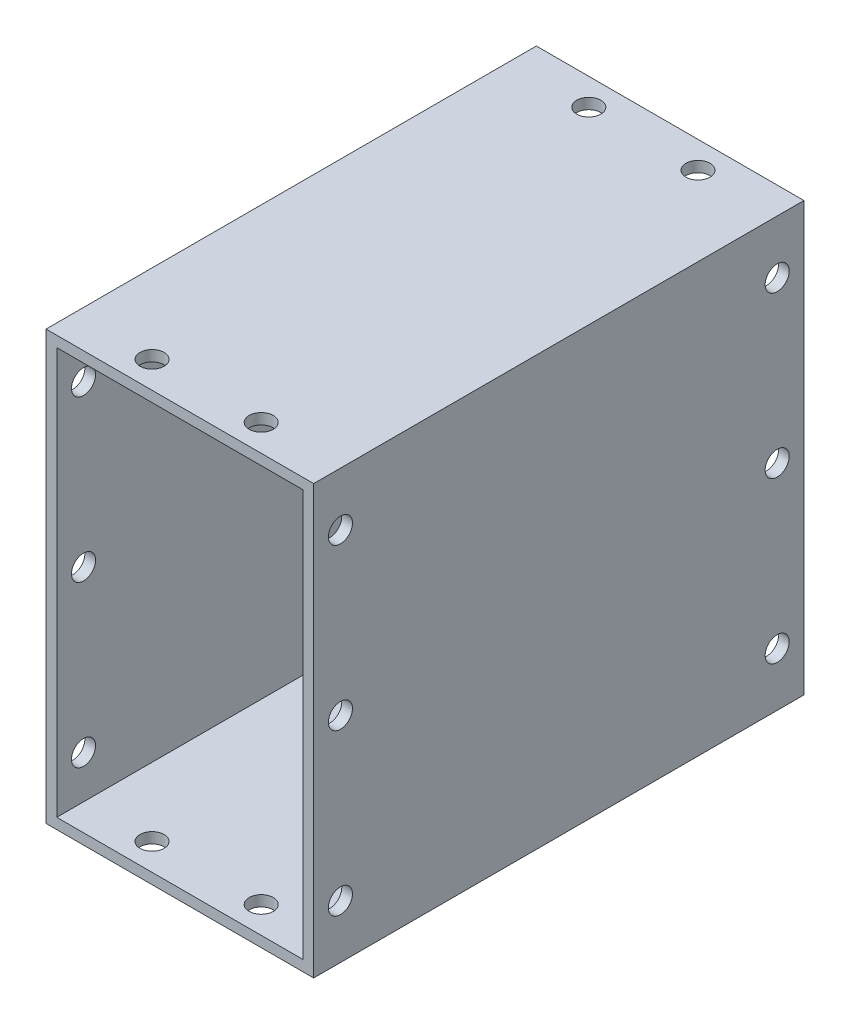
from build123d import *

# Parameters (mm, degrees)
SKETCH1_W                      = 50
SKETCH1_H                      = 80
SKETCH1_W_2                    = 46
SKETCH1_H_2                    = 76
BOSS_EXTRUDE1_DEPTH            = 91.6
M4_CLEARANCE_HOLE1_D           = 4.5
M4_CLEARANCE_HOLE1_ON_FACE_2_D = 4.5
M4_CLEARANCE_HOLE1_ON_FACE_3_D = 4.5
M4_CLEARANCE_HOLE1_ON_FACE_4_D = 4.5


with BuildPart() as part:
    # Sketch1 → Boss-Extrude1 (new body)
    with BuildSketch(Plane.XY.offset(60)):
        Rectangle(SKETCH1_W, SKETCH1_H)
        Rectangle(SKETCH1_W_2, SKETCH1_H_2, mode=Mode.SUBTRACT)
    extrude(amount=BOSS_EXTRUDE1_DEPTH)

    # M4 Clearance Hole1 (through all)
    with Locations(Plane(origin=(25, 30, 65), x_dir=(0, 1, 0), z_dir=(1, 0, 0))):
        with Locations((0, 0), (-30, 0), (-60, 0), (-60, 81.6), (-30, 81.6), (0, 81.6)):
            Hole(M4_CLEARANCE_HOLE1_D / 2)

    # M4 Clearance Hole1 on face 2 (through all)
    with Locations(Plane(origin=(10.2, -40, 65), x_dir=(0, 0, -1), z_dir=(0, -1, 0))):
        with Locations((0, 0), (0, -20.4), (-81.6, -20.4), (-81.6, 0)):
            Hole(M4_CLEARANCE_HOLE1_ON_FACE_2_D / 2)

    # M4 Clearance Hole1 on face 3 (through all)
    with Locations(Plane(origin=(-25, -30, 65), x_dir=(0, 0, -1), z_dir=(-1, 0, 0))):
        with Locations((0, 0), (0, -60), (0, -30), (-81.6, -60), (-81.6, -30), (-81.6, 0)):
            Hole(M4_CLEARANCE_HOLE1_ON_FACE_3_D / 2)

    # M4 Clearance Hole1 on face 4 (through all)
    with Locations(Plane(origin=(10.2, 40, 65), x_dir=(0, 0, 1), z_dir=(0, 1, 0))):
        with Locations((0, 0), (0, -20.4), (81.6, 0), (81.6, -20.4)):
            Hole(M4_CLEARANCE_HOLE1_ON_FACE_4_D / 2)


solid = part.part
